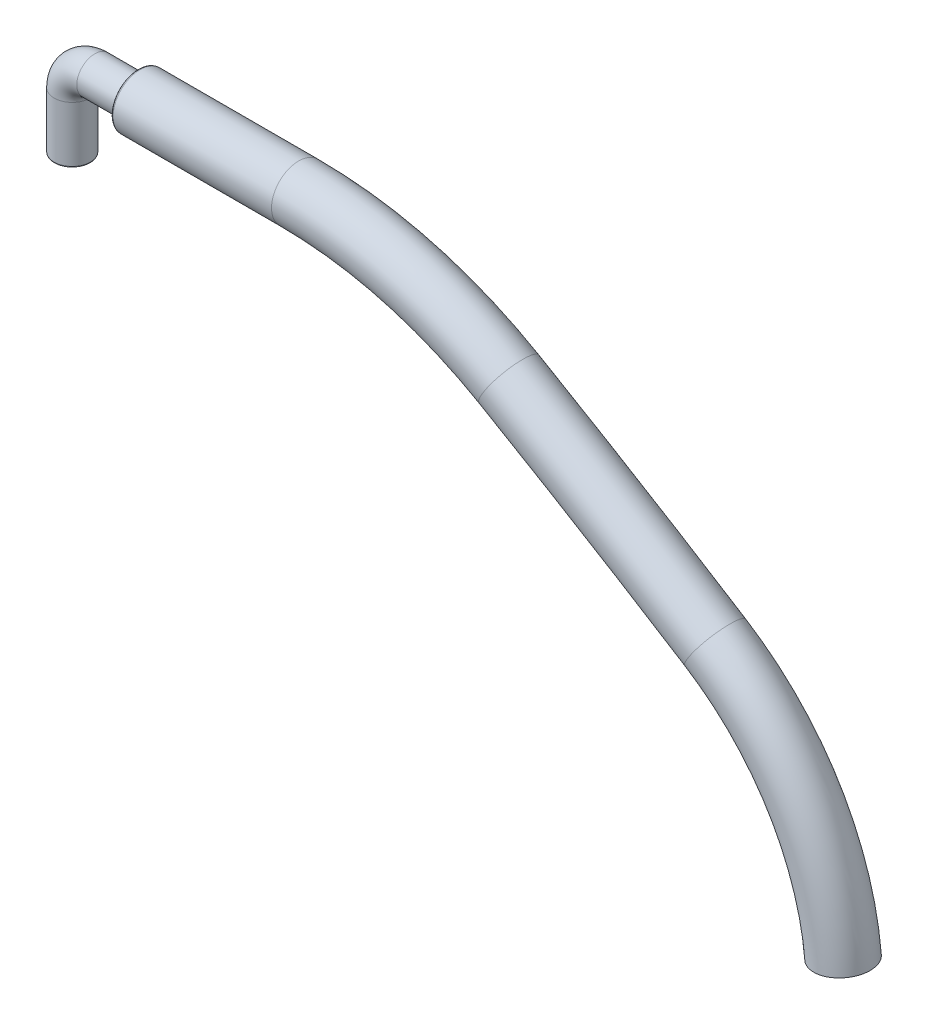
from build123d import *

# Parameters (mm, degrees)
CROQUIS2_R  = 8
VACIADO2_T  = -2
REDONDEO1_R = 0.5
CROQUIS7_R  = 12
VACIADO3_T  = -4
REDONDEO2_R = 1


with BuildPart() as part:
    # Barrer1: sweep along a path in Croquis1
    with BuildLine(Plane.XY) as barrer1_path:
        Line((0, -35), (0, -10))
        ThreePointArc((0, -10), (2.928932188, -2.928932188), (10, 0))
        Line((10, 0), (50, 0))
    # Croquis2 → Barrer1 (sweep)
    with BuildSketch(Plane.XZ.offset(35)):
        Circle(CROQUIS2_R)
    sweep(path=barrer1_path.line)

    # Vaciado2
    vaciado2_openings = [part.faces().sort_by_distance(p)[0] for p in [
        (50, 0, 0),
        (0, -35, 0),
    ]]
    offset(amount=VACIADO2_T, openings=vaciado2_openings, kind=Kind.INTERSECTION)

    # Redondeo1
    redondeo1_edges = [part.edges().sort_by_distance(p)[0] for p in [
        (-8, -35, 0),
        (50, 8, 0),
        (50, 6, 0),
        (-6, -35, 0),
    ]]
    fillet(redondeo1_edges, radius=REDONDEO1_R)


with BuildPart() as body_2:
    # Barrer2: sweep along a path in Croquis6
    with BuildLine(Plane.XY) as barrer2_path:
        Line((29.094637827, 0), (100.157423708, 0))
        ThreePointArc((100.157423708, 0), (148.28040633, -6.352232524), (193.106849682, -24.973786993))
        ThreePointArc((193.106849682, -24.973786993), (239.013356914, -52.160529921), (284.383039562, -80.233974557))
        ThreePointArc((284.383039562, -80.233974557), (323.473601272, -119.926144084), (340.9628487, -172.819116783))
    # Croquis7 → Barrer2 (sweep)
    with BuildSketch(Plane(origin=(29.094637827, 0, 0), x_dir=(0, 0, -1), z_dir=(1, 0, 0))):
        Circle(CROQUIS7_R)
    sweep(path=barrer2_path.line)

    # Vaciado3
    vaciado3_openings = [body_2.faces().sort_by_distance(p)[0] for p in [
        (340.9628487, -172.819116783, 0),
        (29.094637827, 0, 0),
    ]]
    offset(amount=VACIADO3_T, openings=vaciado3_openings, kind=Kind.INTERSECTION)

    # Redondeo2
    redondeo2_edges = [body_2.edges().sort_by_distance(p)[0] for p in [
        (29.094637827, 0, 12),
    ]]
    fillet(redondeo2_edges, radius=REDONDEO2_R)


solid = Compound([part.part, body_2.part])
